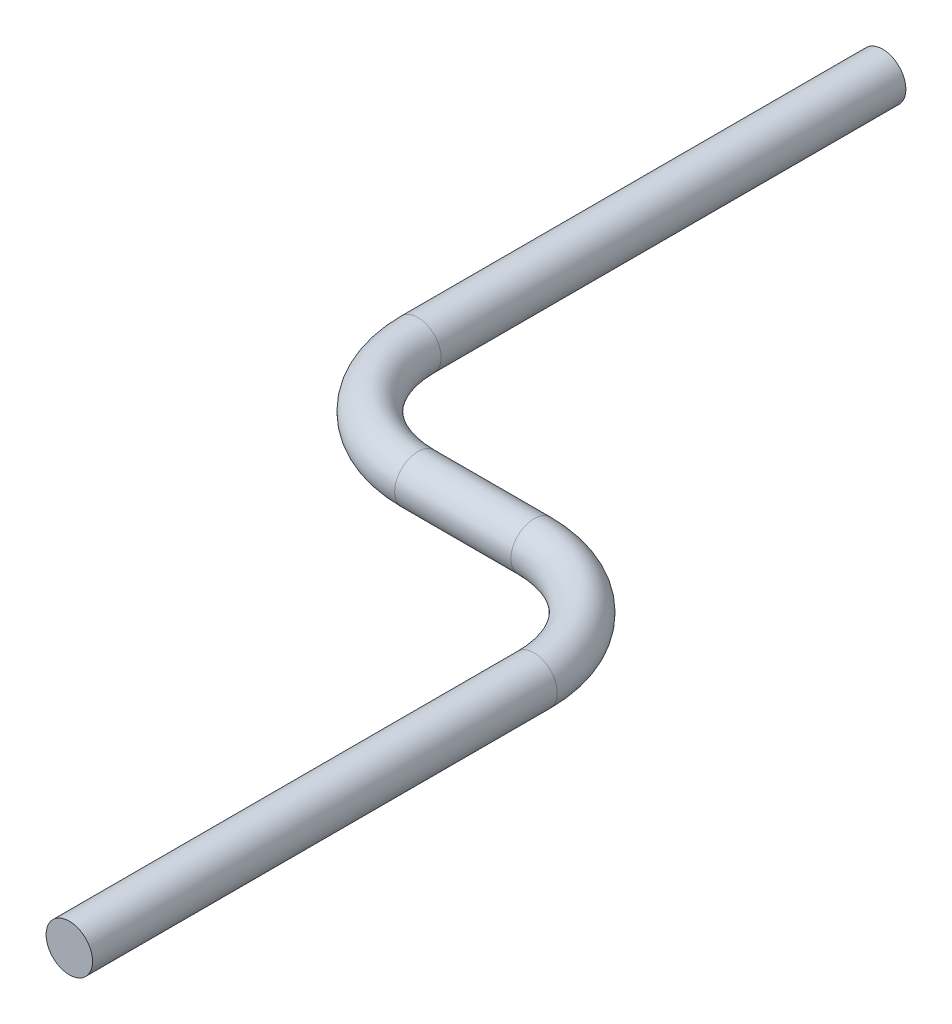
from build123d import *

# Parameters (mm, degrees)
SKETCH_1_R = 2


with BuildPart() as part:
    # ｽｲｰﾌﾟ1: sweep along a path in ｽｹｯﾁ2
    with BuildLine(Plane(origin=(0, 0, 0), x_dir=(1, 0, 0), z_dir=(0, 1, 0))) as sweep_1_path:
        Line((0, 0), (0, -40))
        ThreePointArc((0, -40), (2.928932188, -47.071067812), (10, -50))
        Line((10, -50), (20, -50))
        ThreePointArc((20, -50), (27.071067812, -52.928932188), (30, -60))
        Line((30, -60), (30, -100))
    # ｽｹｯﾁ1 → ｽｲｰﾌﾟ1 (sweep)
    with BuildSketch(Plane.XY):
        Circle(SKETCH_1_R)
    sweep(path=sweep_1_path.line)


solid = part.part
